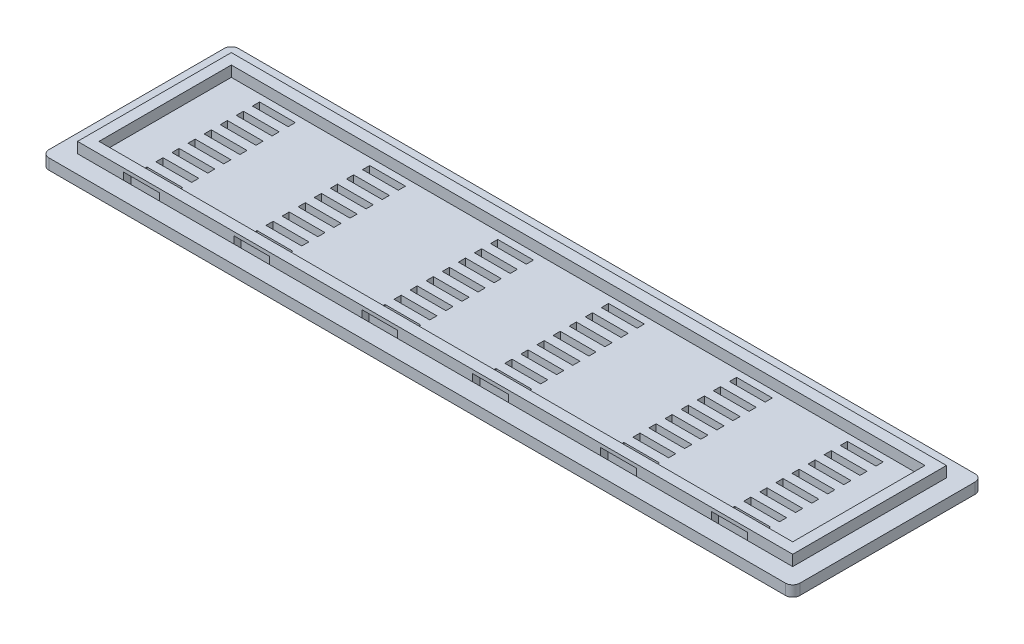
from build123d import *

# Parameters (mm, degrees)
SKETCH_232_W           = 210
SKETCH_232_H           = 53
EXTRUDE_1_DEPTH        = 50
SKETCH_3_W             = 200
SKETCH_3_H             = 43
CUT_EXTRUDE_1_DEPTH    = 45
SKETCH_4_R             = 3.5
EXTRUDE_2_DEPTH        = 2
EXTRUDE_2_TAPER        = 1
FILLET_2_R             = 0.5
SKETCH_4_5_R           = 3.5
EXTRUDE_3_DEPTH        = 2
SKETCH_4_6_R           = 3.5
EXTRUDE_4_DEPTH        = 2
SKETCH_4_7_R           = 3.5
EXTRUDE_5_DEPTH        = 2
FILLET_3_R             = 0.5
FILLET_4_R             = 0.5
FILLET_5_R             = 0.5
SKETCH_7_R             = 6
CUT_EXTRUDE_2_DEPTH    = 14
CUT_EXTRUDE_2_DRAFT    = -5
FILLET_6_R             = 2
SKETCH_8_R             = 7
EXTRUDE_6_DEPTH        = 7
EXTRUDE_6_TAPER        = 5
SKETCH_9_R             = 5.15
CUT_EXTRUDE_3_DEPTH    = 7
CUT_EXTRUDE_3_DRAFT    = 5
SKETCH_10_W            = 29.4
SKETCH_10_H            = 26.3
CUT_EXTRUDE_4_DEPTH    = 5
SKETCH_13_W            = 39.2
SKETCH_13_H            = 27.5
CUT_EXTRUDE_5_DEPTH    = 2
SKETCH_14_W            = 6
SKETCH_14_H            = 6
CUT_EXTRUDE_6_DEPTH    = 5
FILLET_7_R             = 2
EXTRUDE_8_DEPTH        = 3
SKETCH_18_W            = 200
SKETCH_18_H            = 43
SKETCH_18_W_2          = 194
SKETCH_18_H_2          = 37
EXTRUDE_4669_DEPTH     = 3
SKETCH_21_W            = 10
SKETCH_21_H            = 2
CUT_EXTRUDE_12_DEPTH   = 5
PATTERN_LINEAR_1_COUNT = 10
PATTERN_LINEAR_1_PITCH = 4.5


with BuildPart() as part:
    # Sketch 232 → Бобышка-Вытянуть1 (new body)
    with BuildSketch(Plane(origin=(0, 0, 0), x_dir=(1, 0, 0), z_dir=(0, 1, 0))):
        Rectangle(SKETCH_232_W, SKETCH_232_H)
    extrude(amount=EXTRUDE_1_DEPTH)

    # Эскиз3 → Вырез-Вытянуть1 (cut)
    with BuildSketch(Plane.XZ):
        Rectangle(SKETCH_3_W, SKETCH_3_H)
    extrude(amount=-CUT_EXTRUDE_1_DEPTH, mode=Mode.SUBTRACT)

    # Эскиз4 → Бобышка-Вытянуть2 (add)
    with BuildSketch(Plane(origin=(0, 50, 0), x_dir=(1, 0, 0), z_dir=(0, 1, 0))):
        with Locations((98, 19.5)):
            Circle(SKETCH_4_R)
    extrude(amount=EXTRUDE_2_DEPTH, taper=EXTRUDE_2_TAPER)

    # Скругление2
    fillet_2_edges = [part.edges().sort_by_distance(p)[0] for p in [
        (94.53491013, 52, -19.5),
    ]]
    fillet(fillet_2_edges, radius=FILLET_2_R)

    # Эскиз4<5> → Бобышка-Вытянуть3 (add)
    with BuildSketch(Plane(origin=(0, 50, 0), x_dir=(1, 0, 0), z_dir=(0, 1, 0))):
        with Locations(Location((98, -19.5, 0), (0, 0, 90))):
            Circle(SKETCH_4_5_R)
    extrude(amount=EXTRUDE_3_DEPTH)

    # Эскиз4<6> → Бобышка-Вытянуть4 (add)
    with BuildSketch(Plane(origin=(0, 50, 0), x_dir=(1, 0, 0), z_dir=(0, 1, 0))):
        with Locations(Location((-98, -19.5, 0), (0, 0, 270))):
            Circle(SKETCH_4_6_R)
    extrude(amount=EXTRUDE_4_DEPTH)

    # Эскиз4<7> → Бобышка-Вытянуть5 (add)
    with BuildSketch(Plane(origin=(0, 50, 0), x_dir=(1, 0, 0), z_dir=(0, 1, 0))):
        with Locations(Location((-98, 19.5, 0), (0, 0, 90))):
            Circle(SKETCH_4_7_R)
    extrude(amount=EXTRUDE_5_DEPTH)

    # Скругление3
    fillet_3_edges = [part.edges().sort_by_distance(p)[0] for p in [
        (-98, 52, 16),
    ]]
    fillet(fillet_3_edges, radius=FILLET_3_R)

    # Скругление4
    fillet_4_edges = [part.edges().sort_by_distance(p)[0] for p in [
        (-98, 52, -16),
    ]]
    fillet(fillet_4_edges, radius=FILLET_4_R)

    # Скругление5
    fillet_5_edges = [part.edges().sort_by_distance(p)[0] for p in [
        (98, 52, 23),
    ]]
    fillet(fillet_5_edges, radius=FILLET_5_R)


with BuildPart() as cut_extrude_2_tool:
    # Эскиз7 → Вырез-Вытянуть2 (with draft: the straight prism first)
    with BuildSketch(Plane(origin=(0, 0, -26.5), x_dir=(-1, 0, 0), z_dir=(0, 0, -1))):
        with Locations((0, 35.081888724)):
            Circle(SKETCH_7_R)
    extrude(amount=-CUT_EXTRUDE_2_DEPTH)
    # Вырез-Вытянуть2: the draft: its side faces are tilted about the plane it starts from
    cut_extrude_2_sides = [cut_extrude_2_tool.faces().sort_by_distance(p)[0] for p in [
        (6, 35.081888724, -19.5),
    ]]
    draft(cut_extrude_2_sides, Plane(origin=(0, 0, -26.5), x_dir=(-1, 0, 0), z_dir=(0, 0, -1)), CUT_EXTRUDE_2_DRAFT)


with BuildPart() as part_1:
    add(part.part)

    # Вырез-Вытянуть2: cut by cut_extrude_2_tool
    add(cut_extrude_2_tool.part, mode=Mode.SUBTRACT)

    # Скругление6
    fillet_6_edges = [part_1.edges().sort_by_distance(p)[0] for p in [
        (6, 35.081888724, -26.5),
    ]]
    fillet(fillet_6_edges, radius=FILLET_6_R)

    # Эскиз8 → Бобышка-Вытянуть6 (add)
    with BuildSketch(Plane.XY.offset(-21.5)):
        with Locations((0, 35.081888724)):
            Circle(SKETCH_8_R)
    extrude(amount=EXTRUDE_6_DEPTH, taper=EXTRUDE_6_TAPER)


with BuildPart() as cut_extrude_3_tool:
    # Эскиз9 → Вырез-Вытянуть3 (with draft: the straight prism first)
    with BuildSketch(Plane.XY.offset(-14.5)):
        with Locations((0, 35.081888724)):
            Circle(SKETCH_9_R)
    extrude(amount=-CUT_EXTRUDE_3_DEPTH)
    # Вырез-Вытянуть3: the draft: its side faces are tilted about the plane it starts from
    cut_extrude_3_sides = [cut_extrude_3_tool.faces().sort_by_distance(p)[0] for p in [
        (-5.15, 35.081888724, -18),
    ]]
    draft(cut_extrude_3_sides, Plane.XY.offset(-14.5), CUT_EXTRUDE_3_DRAFT)


with BuildPart() as part_2:
    add(part_1.part)

    # Вырез-Вытянуть3: cut by cut_extrude_3_tool
    add(cut_extrude_3_tool.part, mode=Mode.SUBTRACT)

    # Эскиз10 → Вырез-Вытянуть4 (cut)
    with BuildSketch(Plane.XY.offset(26.5)):
        with Locations((-50, 25)):
            Rectangle(SKETCH_10_W, SKETCH_10_H)
    extrude(amount=-CUT_EXTRUDE_4_DEPTH, mode=Mode.SUBTRACT)

    # Эскиз13 → Вырез-Вытянуть5 (cut)
    with BuildSketch(Plane(origin=(0, 0, 21.5), x_dir=(-1, 0, 0), z_dir=(0, 0, -1))):
        with Locations((50, 25)):
            Rectangle(SKETCH_13_W, SKETCH_13_H)
    extrude(amount=-CUT_EXTRUDE_5_DEPTH, mode=Mode.SUBTRACT)

    # Эскиз14 → Вырез-Вытянуть6 (cut)
    with BuildSketch(Plane.XY.offset(26.5)):
        with Locations((-76.5, 31.8)):
            Rectangle(SKETCH_14_W, SKETCH_14_H)
        with Locations((-76.5, 18.2)):
            Rectangle(SKETCH_14_W, SKETCH_14_H)
    extrude(amount=-CUT_EXTRUDE_6_DEPTH, mode=Mode.SUBTRACT)

    # Скругление7
    fillet_7_edges = [part_2.edges().sort_by_distance(p)[0] for p in [
        (-105, 50, 0),
        (0, 50, 26.5),
        (105, 50, 0),
        (105, 25, 26.5),
        (-105, 25, 26.5),
        (-105, 25, -26.5),
        (105, 25, -26.5),
        (0, 50, -26.5),
    ]]
    fillet(fillet_7_edges, radius=FILLET_7_R)


with BuildPart() as body_2:
    # Эскиз17 → Бобышка-Вытянуть8 (new body)
    with BuildSketch(Plane.XZ):
        with BuildLine():
            Line((-105, 24.5), (-105, -24.5))
            ThreePointArc((-105, -24.5), (-104.414213562, -25.914213562), (-103, -26.5))
            Line((-103, -26.5), (103, -26.5))
            ThreePointArc((103, -26.5), (104.414213562, -25.914213562), (105, -24.5))
            Line((105, -24.5), (105, 24.5))
            ThreePointArc((105, 24.5), (104.414213562, 25.914213562), (103, 26.5))
            Line((103, 26.5), (-103, 26.5))
            ThreePointArc((-103, 26.5), (-104.414213562, 25.914213562), (-105, 24.5))
        make_face()
    extrude(amount=EXTRUDE_8_DEPTH)

    # Эскиз18 → Extrude 4669 (add)
    with BuildSketch(Plane(origin=(0, 0, 0), x_dir=(1, 0, 0), z_dir=(0, 1, 0))):
        Rectangle(SKETCH_18_W, SKETCH_18_H)
        Rectangle(SKETCH_18_W_2, SKETCH_18_H_2, mode=Mode.SUBTRACT)
    extrude(amount=EXTRUDE_4669_DEPTH)

    # Эскиз21 → Вырез-Вытянуть12 (cut)
    with BuildSketch(Plane.XZ.offset(3)):
        with Locations((15.5, 20.5)):
            Rectangle(SKETCH_21_W, SKETCH_21_H)
        with Locations((-15.5, 20.5)):
            Rectangle(SKETCH_21_W, SKETCH_21_H)
        with Locations((-51.3, 20.5)):
            Rectangle(SKETCH_21_W, SKETCH_21_H)
        with Locations((-82.1, 20.5)):
            Rectangle(SKETCH_21_W, SKETCH_21_H)
        with Locations((82.3, 20.5)):
            Rectangle(SKETCH_21_W, SKETCH_21_H)
        with Locations((51.3, 20.5)):
            Rectangle(SKETCH_21_W, SKETCH_21_H)
    cut_extrude_12 = extrude(amount=-CUT_EXTRUDE_12_DEPTH, mode=Mode.SUBTRACT)

    # Линейный массив1: Вырез-Вытянуть12 ×10
    with Locations(*[(0, 0, -i * PATTERN_LINEAR_1_PITCH) for i in range(1, PATTERN_LINEAR_1_COUNT)]):
        add(cut_extrude_12, mode=Mode.SUBTRACT)


solid = body_2.part
